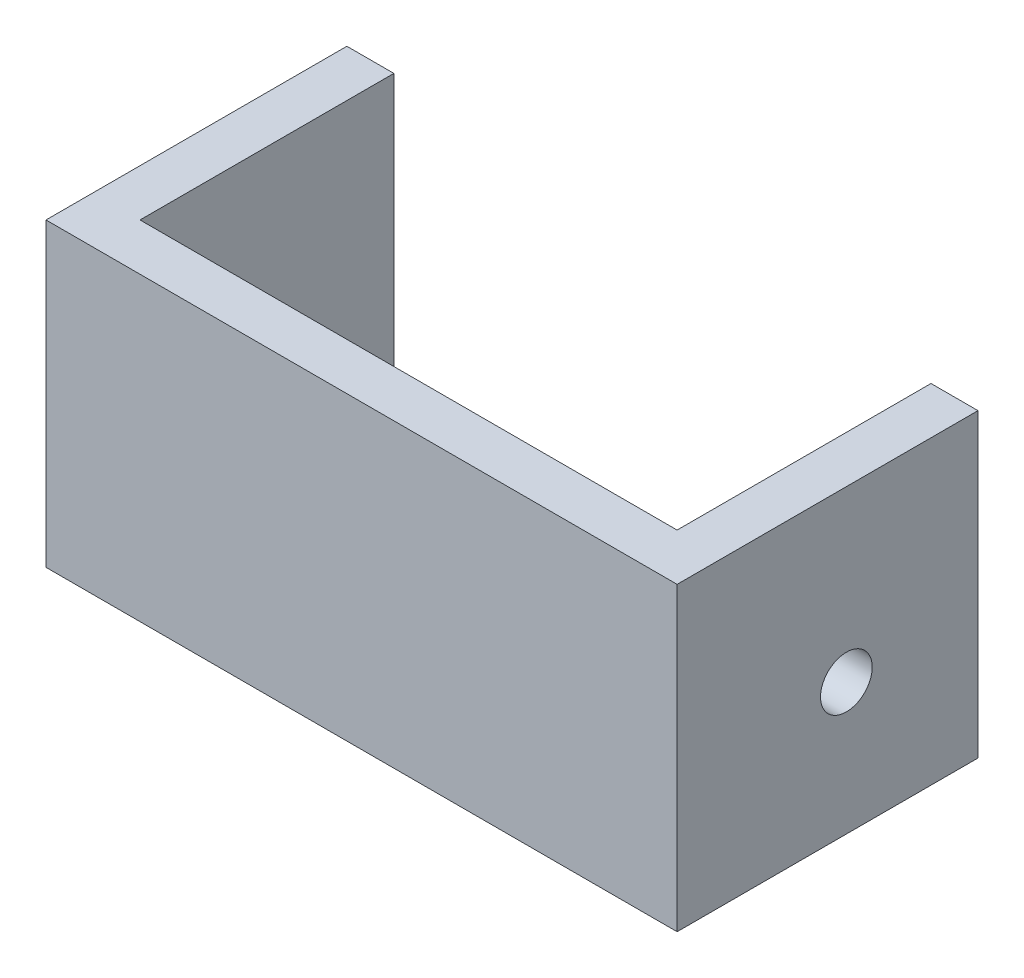
from build123d import *

# Parameters (mm, degrees)
SKETCH1_W           = 67.125
SKETCH1_H           = 32
BOSS_EXTRUDE1_DEPTH = 32
SKETCH2_W           = 57.125
SKETCH2_H           = 27
CUT_EXTRUDE1_DEPTH  = 27
SKETCH3_R           = 2.75
CUT_EXTRUDE2_DEPTH  = 77.0642204


with BuildPart() as part:
    # Sketch1 → Boss-Extrude1 (new body)
    with BuildSketch(Plane.XY):
        Rectangle(SKETCH1_W, SKETCH1_H)
    extrude(amount=BOSS_EXTRUDE1_DEPTH)

    # Sketch2 → Cut-Extrude1 (cut)
    with BuildSketch(Plane(origin=(0, 0, 0), x_dir=(-1, 0, 0), z_dir=(0, 0, -1))):
        with Locations((0, 2.5)):
            Rectangle(SKETCH2_W, SKETCH2_H)
    extrude(amount=-CUT_EXTRUDE1_DEPTH, mode=Mode.SUBTRACT)

    # Sketch3 → Cut-Extrude2 (cut, through all)
    with BuildSketch(Plane(origin=(33.5625, 0, 0), x_dir=(0, 0, -1), z_dir=(1, 0, 0))):
        with Locations((-14, -2)):
            Circle(SKETCH3_R)
    extrude(amount=-CUT_EXTRUDE2_DEPTH, mode=Mode.SUBTRACT)


solid = part.part
